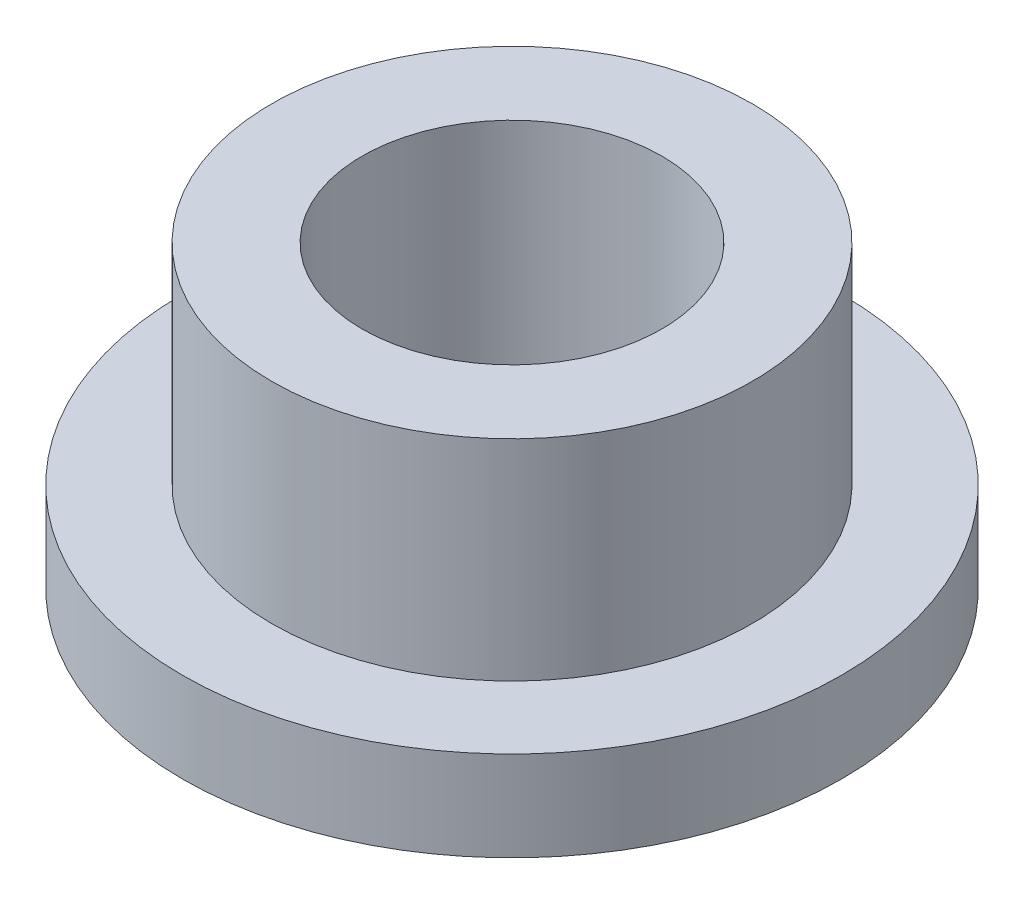
from build123d import *

# Parameters (mm, degrees)
SKETCH2_R           = 4.01
SKETCH2_R_2         = 2.5
BOSS_EXTRUDE1_DEPTH = 5
SKETCH3_R           = 5.5
SKETCH3_R_2         = 4.01
BOSS_EXTRUDE2_DEPTH = 1.5


with BuildPart() as part:
    # Sketch2 → Boss-Extrude1 (new body)
    with BuildSketch(Plane(origin=(0, 0, 0), x_dir=(1, 0, 0), z_dir=(0, 1, 0))):
        with Locations(Location((0, 0, 0), (0, 0, 270))):
            Circle(SKETCH2_R)
        with Locations(Location((0, 0, 0), (0, 0, 270))):
            Circle(SKETCH2_R_2, mode=Mode.SUBTRACT)
    extrude(amount=BOSS_EXTRUDE1_DEPTH)

    # Sketch3 → Boss-Extrude2 (add)
    with BuildSketch(Plane(origin=(0, 0, 0), x_dir=(1, 0, 0), z_dir=(0, 1, 0))):
        with Locations(Location((0, 0, 0), (0, 0, 270))):
            Circle(SKETCH3_R)
        with Locations(Location((0, 0, 0), (0, 0, 270))):
            Circle(SKETCH3_R_2, mode=Mode.SUBTRACT)
    extrude(amount=BOSS_EXTRUDE2_DEPTH)


solid = part.part
